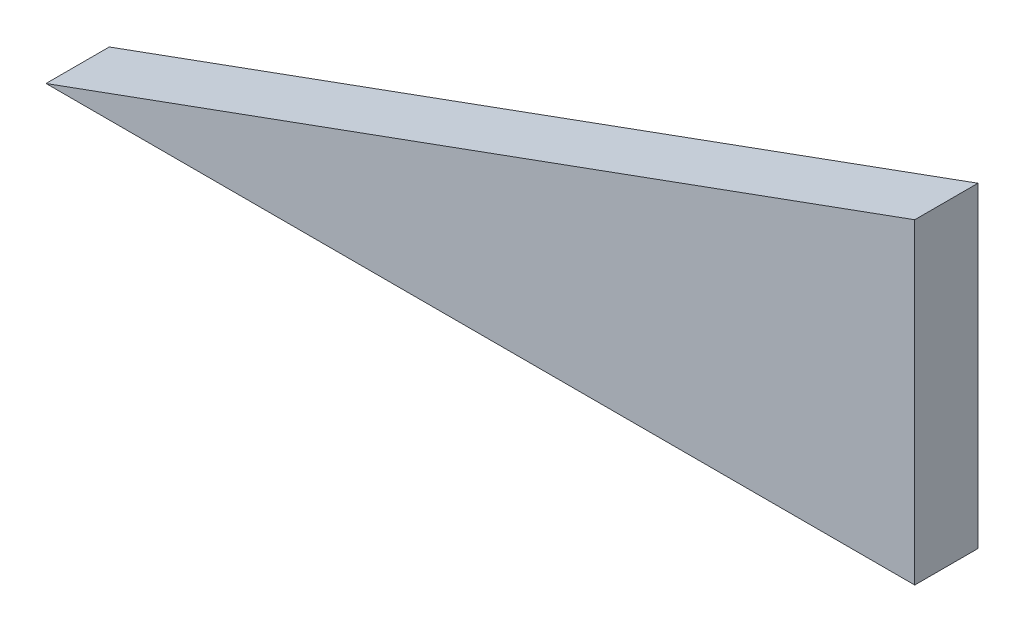
from build123d import *

# Parameters (mm, degrees)
BOSS_EXTRUDE1_DEPTH = 30


with BuildPart() as part:
    # Sketch1 → Boss-Extrude1 (new body)
    with BuildSketch(Plane.XY):
        Polygon((0, 0), (-412, 0), (0, 150.037175164), align=None)
    extrude(amount=BOSS_EXTRUDE1_DEPTH)


solid = part.part
